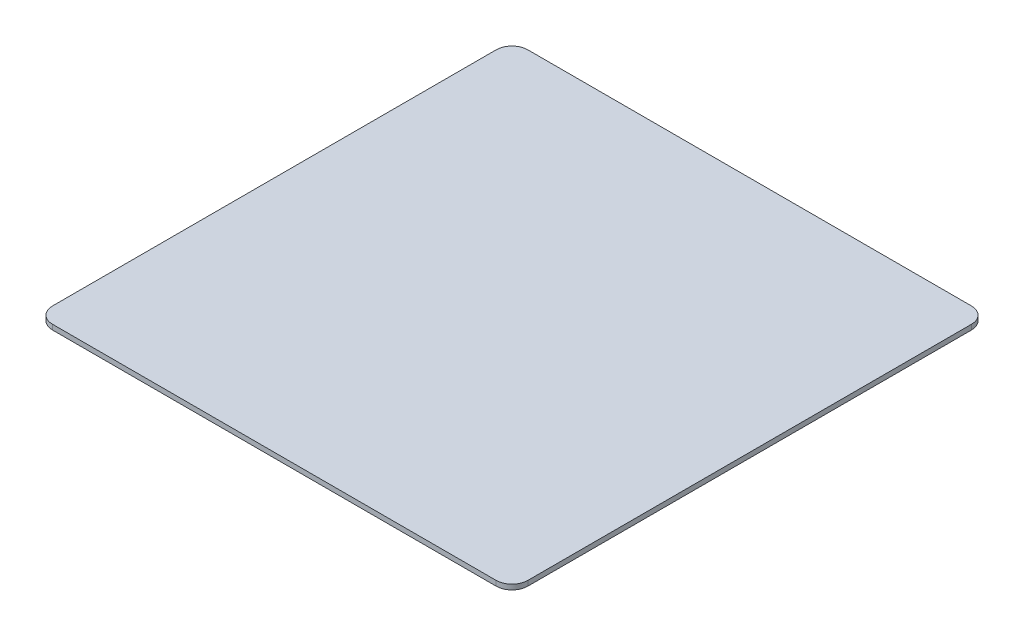
from build123d import *

# Parameters (mm, degrees)
SKETCH1_W           = 300
SKETCH1_H           = 300
BOSS_EXTRUDE1_DEPTH = 1.5875
FILLET1_R           = 10


with BuildPart() as part:
    # Sketch1 → Boss-Extrude1 (new, symmetric)
    with BuildSketch(Plane(origin=(0, 0, 0), x_dir=(1, 0, 0), z_dir=(0, 1, 0))):
        Rectangle(SKETCH1_W, SKETCH1_H)
    extrude(amount=BOSS_EXTRUDE1_DEPTH, both=True)

    # Fillet1
    fillet1_edges = [part.edges().sort_by_distance(p)[0] for p in [
        (-150, 0, -150),
        (150, 0, -150),
        (150, 0, 150),
        (-150, 0, 150),
    ]]
    fillet(fillet1_edges, radius=FILLET1_R)


solid = part.part
